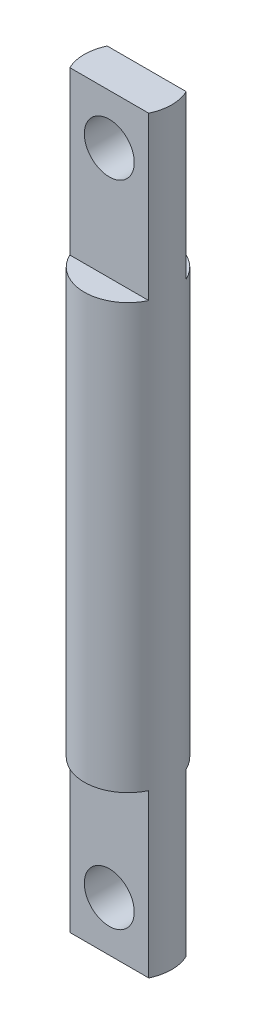
from build123d import *
from build123d.topology import SkipClean

# Parameters (mm, degrees)
EXTRUDE_1_DEPTH      = 17
EXTRUDE_1_DEPTH_BACK = 17
SKETCH_1_R           = 3.5
EXTRUDE_2_DEPTH      = 13
CUT_EXTRUDE_1_REACH  = 32.615
SKETCH_5_R           = 2


with BuildPart() as part:
    # 草图1 → 凸台-拉伸1 (new, two sides: drawn at the far end of the back side and taken through both)
    with BuildSketch(Plane(origin=(0, 0, 0), x_dir=(1, 0, 0), z_dir=(0, 1, 0)).offset(-EXTRUDE_1_DEPTH_BACK)):
        Circle(SKETCH_1_R)
    extrude(amount=EXTRUDE_1_DEPTH + EXTRUDE_1_DEPTH_BACK)

    # 草图2 → 凸台-拉伸2 (add)
    with SkipClean():  # the faces are left unmerged after this step: merging them gives an invalid solid
        with BuildSketch(Plane.XZ.offset(17)):
            with BuildLine():
                Line((3.16227766, 1.5), (-3.16227766, 1.5))
                ThreePointArc((-3.16227766, 1.5), (-3.5, 0), (-3.16227766, -1.5))
                Line((-3.16227766, -1.5), (3.16227766, -1.5))
                ThreePointArc((3.16227766, -1.5), (3.414525722, -0.768774411), (3.5, 0))
                ThreePointArc((3.5, 0), (3.414525722, 0.768774411), (3.16227766, 1.5))
            make_face()
        extrude_2 = extrude(amount=EXTRUDE_2_DEPTH)

    # 草图5 → 切除-拉伸1 (cut, up to next)
    with BuildSketch(Plane(origin=(0, 0, -1.5), x_dir=(-1, 0, 0), z_dir=(0, 0, -1)), mode=Mode.PRIVATE) as cut_extrude_1_sk1:
        with Locations((0, -26)):
            Circle(SKETCH_5_R)
    cut_extrude_1_tool1 = extrude(cut_extrude_1_sk1.sketch, amount=-CUT_EXTRUDE_1_REACH, mode=Mode.PRIVATE) & part.part
    cut_extrude_1 = cut_extrude_1_tool1.solids().sort_by_distance((0, -26, -1.5))[0]
    add(cut_extrude_1, mode=Mode.SUBTRACT)

    # 镜向2: 凸台-拉伸2, 切除-拉伸1 across plane
    with SkipClean():  # the faces are left unmerged after this step: merging them gives an invalid solid
        add(extrude_2.mirror(Plane.ZX))
        add(cut_extrude_1.mirror(Plane.ZX), mode=Mode.SUBTRACT)


solid = part.part
